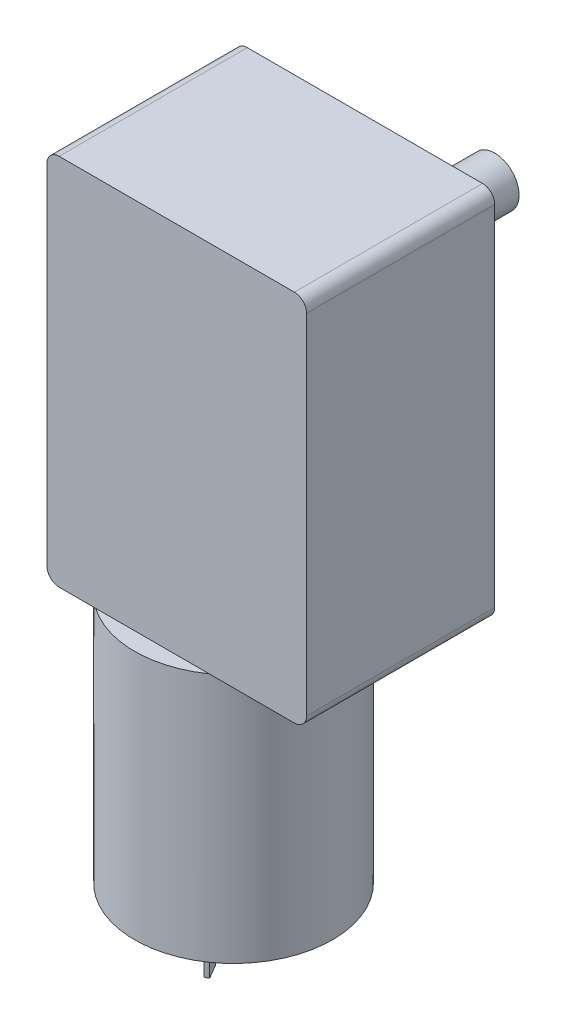
from build123d import *

# Parameters (mm, degrees)
SKETCH1_W           = 32
SKETCH1_H           = 46
BOSS_EXTRUDE1_DEPTH = 23.2
SKETCH2_R           = 3.85
SKETCH2_R_2         = 6.65
BOSS_EXTRUDE2_DEPTH = 2
SKETCH3_R           = 1.5
CUT_EXTRUDE1_DEPTH  = 4
SKETCH4_R           = 3
BOSS_EXTRUDE3_DEPTH = 14
CUT_EXTRUDE2_START  = -12
CUT_EXTRUDE2_DEPTH  = 12
FILLET1_R           = 1.5
SKETCH6_R           = 12.2
BOSS_EXTRUDE4_DEPTH = 30.8
SKETCH7_R           = 3.2
BOSS_EXTRUDE5_DEPTH = 2.2
FILLET2_R           = 1
BOSS_EXTRUDE6_DEPTH = 4


with BuildPart() as part:
    # Sketch1 → Boss-Extrude1 (new body)
    with BuildSketch(Plane.XY):
        with Locations((0, -8)):
            Rectangle(SKETCH1_W, SKETCH1_H)
    extrude(amount=BOSS_EXTRUDE1_DEPTH)

    # Sketch2 → Boss-Extrude2 (add)
    with BuildSketch(Plane(origin=(0, 0, 0), x_dir=(-1, 0, 0), z_dir=(0, 0, -1))):
        with Locations(Location((-9, 9, 0), (0, 0, 180))):
            Circle(SKETCH2_R)
        with Locations(Location((9, 9, 0), (0, 0, 180))):
            Circle(SKETCH2_R)
        with Locations(Location((-9, -24, 0), (0, 0, 180))):
            Circle(SKETCH2_R)
        with Locations(Location((9, -24, 0), (0, 0, 180))):
            Circle(SKETCH2_R)
        with Locations(Location((0, 0, 0), (0, 0, 180))):
            Circle(SKETCH2_R_2)
        with BuildLine():
            Line((-5, -10), (5, -10))
            ThreePointArc((5, -10), (8, -13), (5, -16))
            Line((5, -16), (-5, -16))
            ThreePointArc((-5, -16), (-8, -13), (-5, -10))
        make_face()
    extrude(amount=BOSS_EXTRUDE2_DEPTH)

    # Sketch3 → Cut-Extrude1 (cut)
    with BuildSketch(Plane(origin=(0, 0, -2), x_dir=(-1, 0, 0), z_dir=(0, 0, -1))):
        with Locations((9, 9)):
            Circle(SKETCH3_R)
        with Locations((-9, 9)):
            Circle(SKETCH3_R)
        with Locations((-9, -24)):
            Circle(SKETCH3_R)
        with Locations((9, -24)):
            Circle(SKETCH3_R)
    extrude(amount=-CUT_EXTRUDE1_DEPTH, mode=Mode.SUBTRACT)

    # Sketch4 → Boss-Extrude3 (add)
    with BuildSketch(Plane(origin=(0, 0, -2), x_dir=(-1, 0, 0), z_dir=(0, 0, -1))):
        Circle(SKETCH4_R)
    extrude(amount=BOSS_EXTRUDE3_DEPTH)

    # Sketch5 → Cut-Extrude2 (cut)
    with BuildSketch(Plane(origin=(0, 0, -16), x_dir=(-1, 0, 0), z_dir=(0, 0, -1)).offset(CUT_EXTRUDE2_START)):
        with BuildLine():
            Line((2.5, 1.658312395), (2.5, -1.658312395))
            ThreePointArc((2.5, -1.658312395), (2.872281323, -0.866025404), (3, 0))
            ThreePointArc((3, 0), (2.872281323, 0.866025404), (2.5, 1.658312395))
        make_face()
    extrude(amount=CUT_EXTRUDE2_DEPTH, mode=Mode.SUBTRACT)

    # Fillet1
    fillet1_edges = [part.edges().sort_by_distance(p)[0] for p in [
        (-16, 15, 11.6),
        (16, 15, 11.6),
        (16, -31, 11.6),
        (-16, -31, 11.6),
    ]]
    fillet(fillet1_edges, radius=FILLET1_R)

    # Sketch6 → Boss-Extrude4 (add)
    with BuildSketch(Plane.XZ.offset(31)):
        with Locations(Location((-3, 13.2, 0), (0, 0, 124.94801372))):
            Circle(SKETCH6_R)
    extrude(amount=BOSS_EXTRUDE4_DEPTH)

    # Sketch7 → Boss-Extrude5 (add)
    with BuildSketch(Plane.XZ.offset(61.8)):
        with Locations(Location((-3, 13.2, 0), (0, 0, 270))):
            Circle(SKETCH7_R)
    extrude(amount=BOSS_EXTRUDE5_DEPTH)

    # Fillet2
    fillet2_edges = [part.edges().sort_by_distance(p)[0] for p in [
        (-3, -64, 16.4),
    ]]
    fillet(fillet2_edges, radius=FILLET2_R)

    # Sketch8 → Boss-Extrude6 (add)
    with BuildSketch(Plane.XZ.offset(61.8)):
        with BuildLine():
            Line((1.267616567, 21.091728722), (0.299370731, 19.414677739))
            ThreePointArc((0.299370731, 19.414677739), (0.5, 19.262177826), (0.732383433, 19.164677739))
            Line((0.732383433, 19.164677739), (1.700629269, 20.841728722))
            ThreePointArc((1.700629269, 20.841728722), (1.5, 20.994228634), (1.267616567, 21.091728722))
        make_face()
        with BuildLine():
            Line((-6.299370731, 6.985322261), (-7.267616567, 5.308271278))
            ThreePointArc((-7.267616567, 5.308271278), (-7.5, 5.405771366), (-7.700629269, 5.558271278))
            Line((-7.700629269, 5.558271278), (-6.732383433, 7.235322261))
            ThreePointArc((-6.732383433, 7.235322261), (-6.5, 7.137822174), (-6.299370731, 6.985322261))
        make_face()
    extrude(amount=BOSS_EXTRUDE6_DEPTH)


solid = part.part
